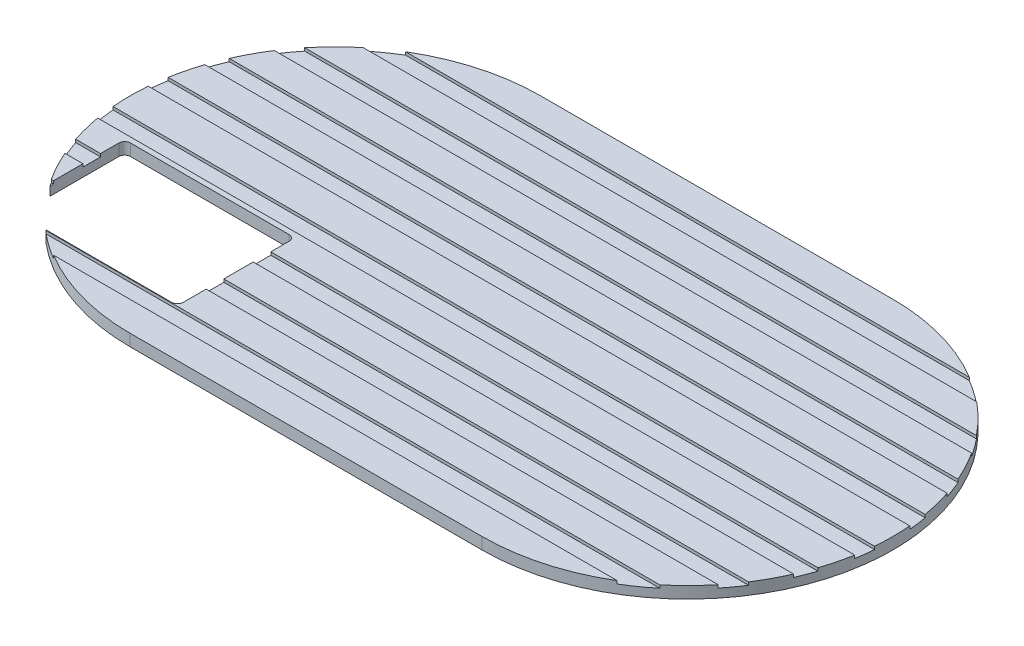
from build123d import *

# Parameters (mm, degrees)
BOSS_EXTRUDE1_DEPTH     = 2
SKETCH2_W               = 110.931662833
SKETCH2_H               = 3
SKETCH2_W_2             = 124.512387616
SKETCH2_W_3             = 131.50444394
SKETCH2_W_4             = 133.924771129
CUT_EXTRUDE1_DEPTH      = 0.5
CUT_EXTRUDE3_DEPTH      = 102.262036322
CUT_EXTRUDE3_DEPTH_BACK = 102.262036322
SKETCH3_W               = 29
SKETCH3_H               = 20
FILLET1_R               = 1


with BuildPart() as part:
    # Sketch1 → Boss-Extrude1 (new body)
    with BuildSketch(Plane(origin=(0, 0, 0), x_dir=(1, 0, 0), z_dir=(0, 1, 0))):
        with BuildLine():
            Line((0, 35), (-60, 35))
            ThreePointArc((-60, 35), (-95, 0), (-60, -35))
            Line((-60, -35), (0, -35))
            ThreePointArc((0, -35), (35, 0), (0, 35))
        make_face()
    extrude(amount=BOSS_EXTRUDE1_DEPTH)

    # Sketch2 → Cut-Extrude1 (cut)
    with BuildSketch(Plane(origin=(0, 2, 0), x_dir=(1, 0, 0), z_dir=(0, 1, 0))):
        with Locations((-30.336156555, 28.5)):
            Rectangle(SKETCH2_W, SKETCH2_H)
        with Locations((-30, 20.5)):
            Rectangle(SKETCH2_W_2, SKETCH2_H)
        with Locations((-29.865537378, 12.5)):
            Rectangle(SKETCH2_W_3, SKETCH2_H)
        with Locations((-28.655373784, 4.5)):
            Rectangle(SKETCH2_W_4, SKETCH2_H)
        with Locations((-28.655373784, -4.5)):
            Rectangle(SKETCH2_W_4, SKETCH2_H)
        with Locations((-29.865537378, -12.5)):
            Rectangle(SKETCH2_W_3, SKETCH2_H)
        with Locations((-30, -20.5)):
            Rectangle(SKETCH2_W_2, SKETCH2_H)
        with Locations((-30.336156555, -28.5)):
            Rectangle(SKETCH2_W, SKETCH2_H)
    extrude(amount=-CUT_EXTRUDE1_DEPTH, mode=Mode.SUBTRACT)

    # Sketch3 → Cut-Extrude3 (cut, two sides: drawn at the far end of the back side and taken through both)
    with BuildSketch(Plane(origin=(0, 0, 0), x_dir=(1, 0, 0), z_dir=(0, 1, 0)).offset(-CUT_EXTRUDE3_DEPTH_BACK)):
        with Locations((-74.5, -16.892498432)):
            Rectangle(SKETCH3_W, SKETCH3_H)
    extrude(amount=CUT_EXTRUDE3_DEPTH + CUT_EXTRUDE3_DEPTH_BACK, mode=Mode.SUBTRACT)

    # Fillet1
    fillet1_edges = [part.edges().sort_by_distance(p)[0] for p in [
        (-60, 1, 6.892498432),
        (-89, 1, 6.892498432),
        (-60, 1, 26.892498432),
    ]]
    fillet(fillet1_edges, radius=FILLET1_R)


solid = part.part
